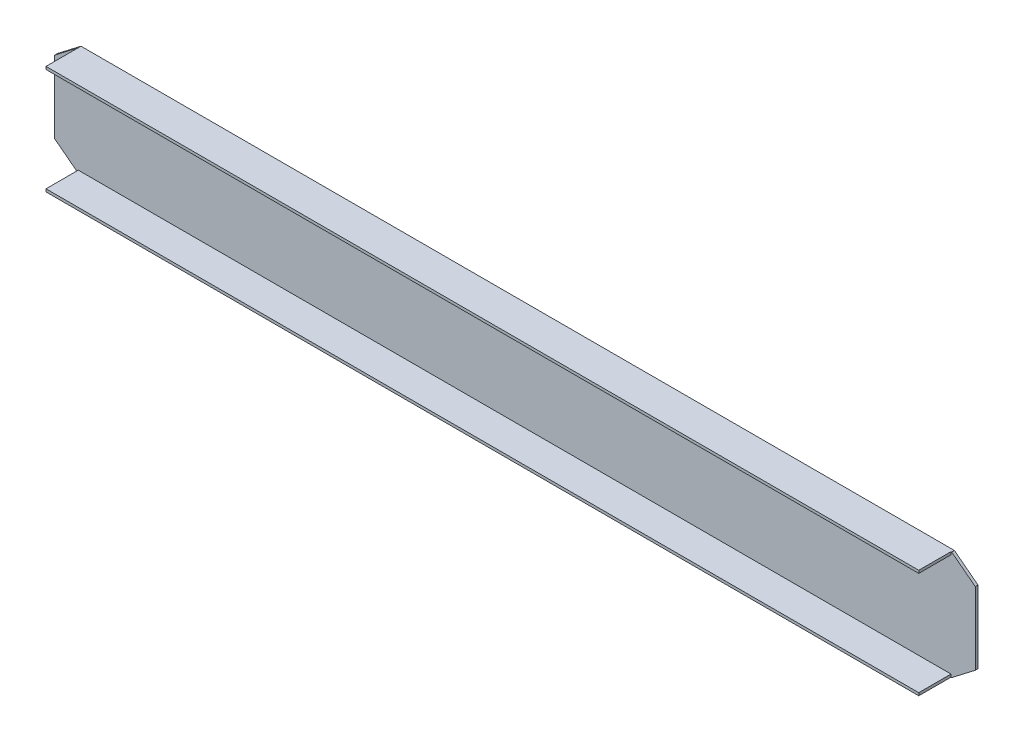
from build123d import *

# Parameters (mm, degrees)
EXTRUDE_646_DEPTH = 7.5
SKETCH_2_W        = 2408.049034164
SKETCH_2_H        = 7.5
EXTRUDE_1_DEPTH   = 89
SKETCH_3_W        = 80
SKETCH_3_H        = 240
EXTRUDE_2_DEPTH   = 16


with BuildPart() as part:
    # 草图1 → Extrude 646 (new body)
    with BuildSketch(Plane.XY):
        Polygon((-1205, 0), (1205, 0), (1270, 50), (1270, 250), (1205, 300), (-1205, 300), (-1270, 250), (-1270, 50), align=None)
    extrude(amount=-EXTRUDE_646_DEPTH)

    # 草图2 → 凸台-拉伸1 (add)
    with BuildSketch(Plane.XY):
        with Locations((-0.975482918, 296.25)):
            Rectangle(SKETCH_2_W, SKETCH_2_H)
        with Locations((-0.975482918, 3.75)):
            Rectangle(SKETCH_2_W, SKETCH_2_H)
    extrude(amount=EXTRUDE_1_DEPTH)

    # 草图3 → 凸台-拉伸2 (add)
    with BuildSketch(Plane(origin=(0, 0, -7.5), x_dir=(-1, 0, 0), z_dir=(0, 0, -1))):
        with Locations((-580, 150)):
            Rectangle(SKETCH_3_W, SKETCH_3_H)
        with Locations((-180, 150)):
            Rectangle(SKETCH_3_W, SKETCH_3_H)
        with Locations((180, 150)):
            Rectangle(SKETCH_3_W, SKETCH_3_H)
        with Locations((580, 150)):
            Rectangle(SKETCH_3_W, SKETCH_3_H)
    extrude(amount=EXTRUDE_2_DEPTH)


solid = part.part
